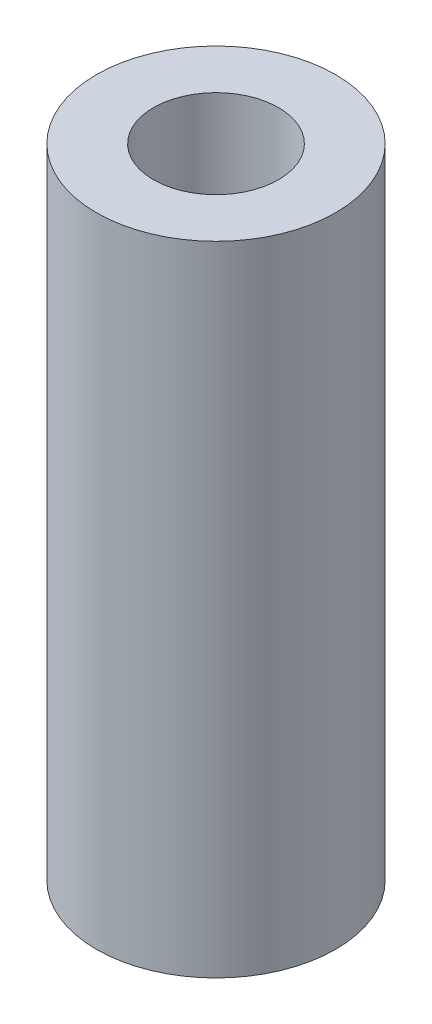
from build123d import *

# Parameters (mm, degrees)
SKETCH1_R           = 4.7625
SKETCH1_R_2         = 2.4892
BOSS_EXTRUDE1_DEPTH = 12.7


with BuildPart() as part:
    # Sketch1 → Boss-Extrude1 (new, symmetric)
    with BuildSketch(Plane(origin=(0, 0, 0), x_dir=(1, 0, 0), z_dir=(0, 1, 0))):
        with Locations(Location((0, 0, 0), (0, 0, 270))):
            Circle(SKETCH1_R)
        with Locations(Location((0, 0, 0), (0, 0, 270))):
            Circle(SKETCH1_R_2, mode=Mode.SUBTRACT)
    extrude(amount=BOSS_EXTRUDE1_DEPTH, both=True)


solid = part.part
